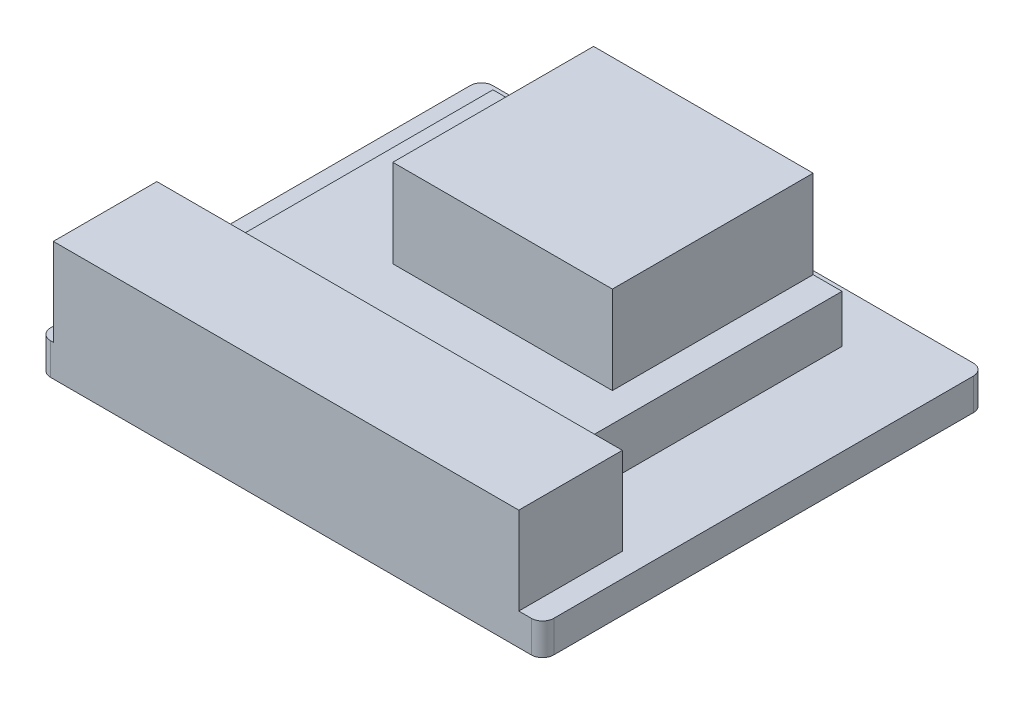
from build123d import *

# Parameters (mm, degrees)
BOSS_EXTRUDE1_DEPTH = 6.5
SKETCH2_W           = 95.29
SKETCH2_H           = 21.2
BOSS_EXTRUDE2_DEPTH = 17.9
SKETCH3_W           = 71.45
SKETCH3_H           = 51
BOSS_EXTRUDE3_DEPTH = 9.77
SKETCH4_W           = 44.95
SKETCH4_H           = 41.1
BOSS_EXTRUDE4_DEPTH = 18


with BuildPart() as part:
    # Sketch1 → Boss-Extrude1 (new body)
    with BuildSketch(Plane(origin=(0, 0, 0), x_dir=(1, 0, 0), z_dir=(0, 1, 0))):
        with BuildLine():
            Line((-51.5, -42.95), (-51.5, 42.95))
            ThreePointArc((-51.5, 42.95), (-50.826345597, 44.576345597), (-49.2, 45.25))
            Line((-49.2, 45.25), (49.2, 45.25))
            ThreePointArc((49.2, 45.25), (50.826345597, 44.576345597), (51.5, 42.95))
            Line((51.5, 42.95), (51.5, -42.95))
            ThreePointArc((51.5, -42.95), (50.826345597, -44.576345597), (49.2, -45.25))
            Line((49.2, -45.25), (-49.2, -45.25))
            ThreePointArc((-49.2, -45.25), (-50.826345597, -44.576345597), (-51.5, -42.95))
        make_face()
    extrude(amount=BOSS_EXTRUDE1_DEPTH)

    # Sketch2 → Boss-Extrude2 (add)
    with BuildSketch(Plane(origin=(0, 6.5, 0), x_dir=(1, 0, 0), z_dir=(0, 1, 0))):
        with Locations((-1.005, -34.65)):
            Rectangle(SKETCH2_W, SKETCH2_H)
    extrude(amount=BOSS_EXTRUDE2_DEPTH)

    # Sketch3 → Boss-Extrude3 (add)
    with BuildSketch(Plane(origin=(0, 6.5, 0), x_dir=(1, 0, 0), z_dir=(0, 1, 0))):
        with Locations((-2.925, 9.25)):
            Rectangle(SKETCH3_W, SKETCH3_H)
    extrude(amount=BOSS_EXTRUDE3_DEPTH)

    # Sketch4 → Boss-Extrude4 (add)
    with BuildSketch(Plane(origin=(0, 16.27, 0), x_dir=(1, 0, 0), z_dir=(0, 1, 0))):
        with Locations((4.425, 14.2)):
            Rectangle(SKETCH4_W, SKETCH4_H)
    extrude(amount=BOSS_EXTRUDE4_DEPTH)


solid = part.part
